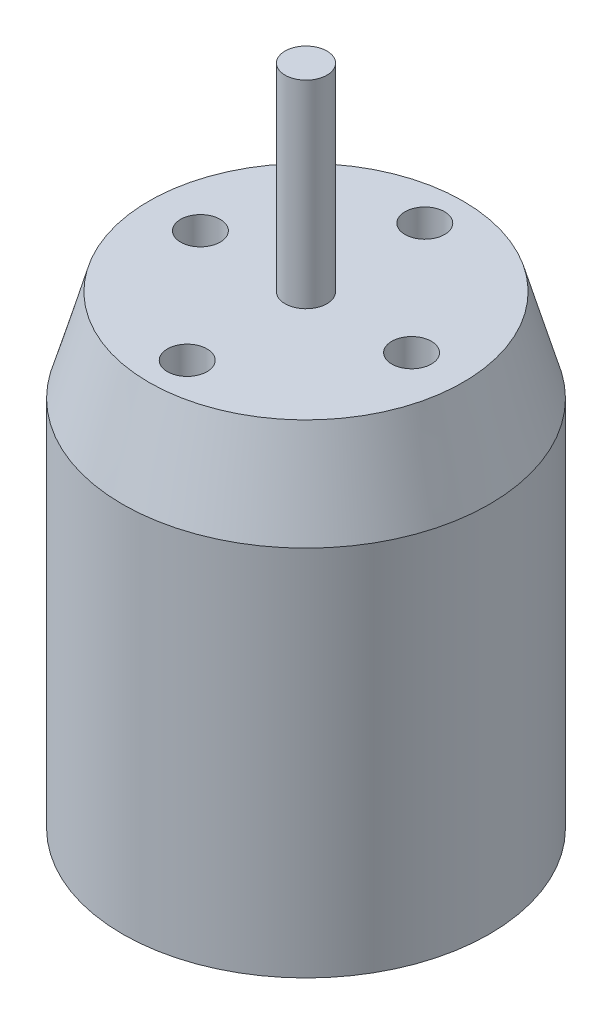
from build123d import *

# Parameters (mm, degrees)
SKETCH1_R           = 13.9
BOSS_EXTRUDE1_DEPTH = 35.2
SKETCH2_R           = 1.585
BOSS_EXTRUDE2_DEPTH = 15
SKETCH4_R           = 1.5
CUT_EXTRUDE1_DEPTH  = 7
CHAMFER1_SIZE       = 7
CHAMFER1_SIZE2      = 2
SKETCH5_R           = 4.5
BOSS_EXTRUDE3_DEPTH = 5


with BuildPart() as part:
    # Sketch1 → Boss-Extrude1 (new body)
    with BuildSketch(Plane(origin=(0, 0, 0), x_dir=(1, 0, 0), z_dir=(0, 1, 0))):
        with Locations(Location((0, 0, 0), (0, 0, 270))):
            Circle(SKETCH1_R)
    extrude(amount=BOSS_EXTRUDE1_DEPTH)

    # Sketch2 → Boss-Extrude2 (add)
    with BuildSketch(Plane(origin=(0, 35.2, 0), x_dir=(1, 0, 0), z_dir=(0, 1, 0))):
        with Locations(Location((0, 0, 0), (0, 0, 270))):
            Circle(SKETCH2_R)
    extrude(amount=BOSS_EXTRUDE2_DEPTH)

    # Sketch4 → Cut-Extrude1 (cut)
    with BuildSketch(Plane(origin=(0, 35.2, 0), x_dir=(1, 0, 0), z_dir=(0, 1, 0))):
        with Locations(Location((0, 9, 0), (0, 0, 270))):
            Circle(SKETCH4_R)
        with Locations(Location((-8, 0, 0), (0, 0, 270))):
            Circle(SKETCH4_R)
        with Locations(Location((8, 0, 0), (0, 0, 270))):
            Circle(SKETCH4_R)
        with Locations(Location((0, -9, 0), (0, 0, 270))):
            Circle(SKETCH4_R)
    extrude(amount=-CUT_EXTRUDE1_DEPTH, mode=Mode.SUBTRACT)

    # Chamfer1
    chamfer1_edges = [part.edges().sort_by_distance(p)[0] for p in [
        (0, 35.2, -13.9),
    ]]
    chamfer1_side = [part.faces().sort_by_distance(p)[0] for p in [
        (0, 17.6, -13.9),
    ]]
    chamfer(chamfer1_edges, length=CHAMFER1_SIZE, length2=CHAMFER1_SIZE2, reference=chamfer1_side[0])

    # Sketch5 → Boss-Extrude3 (add)
    with BuildSketch(Plane.XZ):
        with Locations(Location((0, 0, 0), (0, 0, 270))):
            Circle(SKETCH5_R)
    extrude(amount=BOSS_EXTRUDE3_DEPTH)


solid = part.part
